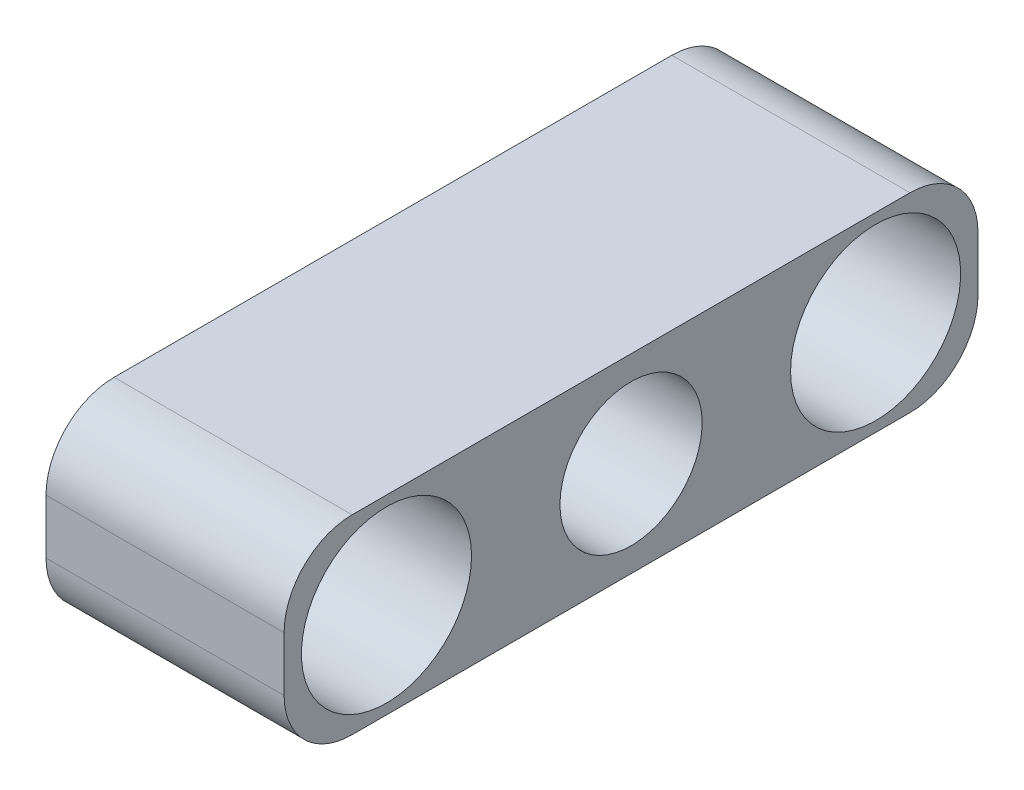
from build123d import *

# Parameters (mm, degrees)
BOSS_EXTRUDE1_START  = -17
BOSS_EXTRUDE1_DEPTH  = 35
SKETCH2_R            = 10.45
CUT_EXTRUDE1_DEPTH   = 32
SKETCH3_R            = 6.5
CUT_EXTRUDE2_DEPTH   = 62.814237842
SKETCH4_R            = 12.5
CUT_EXTRUDE3_DEPTH   = 64.419239983
FILLET5_R            = 10
FILLET6_R            = 10
FILLET5_OF_MIRROR1_R = 10
FILLET6_OF_MIRROR1_R = 10


with BuildPart() as part:
    # Sketch1 → Boss-Extrude1 (new body)
    with BuildSketch(Plane.YZ.offset(BOSS_EXTRUDE1_START)):
        with BuildLine():
            Line((-14, 0), (-14, 51))
            Line((-14, 51), (14, 51))
            Line((14, 51), (14, 0))
            ThreePointArc((14, 0), (0, -14), (-14, 0))
        make_face()
    boss_extrude1 = extrude(amount=BOSS_EXTRUDE1_DEPTH)

    # Sketch2 → Cut-Extrude1 (cut)
    with BuildSketch(Plane.YZ.offset(18)):
        with Locations(Location((0, 0, 0), (0, 0, 270))):
            Circle(SKETCH2_R)
    cut_extrude1 = extrude(amount=-CUT_EXTRUDE1_DEPTH, mode=Mode.SUBTRACT)

    # Sketch3 → Cut-Extrude2 (cut, through all)
    with BuildSketch(Plane.YZ.offset(-14)):
        with Locations(Location((0, 0, 0), (0, 0, 270))):
            Circle(SKETCH3_R)
    cut_extrude2 = extrude(amount=-CUT_EXTRUDE2_DEPTH, mode=Mode.SUBTRACT)

    # Sketch4 → Cut-Extrude3 (cut, through all)
    with BuildSketch(Plane.YZ.offset(18)):
        with Locations(Location((0, 35.95, 0), (0, 0, 270))):
            Circle(SKETCH4_R)
    cut_extrude3 = extrude(amount=-CUT_EXTRUDE3_DEPTH, mode=Mode.SUBTRACT)

    # Fillet5
    fillet5_edges = [part.edges().sort_by_distance(p)[0] for p in [
        (0.5, 14, 51),
    ]]
    fillet(fillet5_edges, radius=FILLET5_R)

    # Fillet6
    fillet6_edges = [part.edges().sort_by_distance(p)[0] for p in [
        (0.5, -14, 51),
    ]]
    fillet(fillet6_edges, radius=FILLET6_R)

    # Mirror1: Boss-Extrude1, Cut-Extrude1, Cut-Extrude2, Cut-Extrude3 across plane
    add(boss_extrude1.mirror(Plane.XY))
    add(cut_extrude1.mirror(Plane.XY), mode=Mode.SUBTRACT)
    add(cut_extrude2.mirror(Plane.XY), mode=Mode.SUBTRACT)
    add(cut_extrude3.mirror(Plane.XY), mode=Mode.SUBTRACT)

    # Fillet5 of Mirror1
    fillet5_of_mirror1_edges = [part.edges().sort_by_distance(p)[0] for p in [
        (0.5, 14, -51),
    ]]
    fillet(fillet5_of_mirror1_edges, radius=FILLET5_OF_MIRROR1_R)

    # Fillet6 of Mirror1
    fillet6_of_mirror1_edges = [part.edges().sort_by_distance(p)[0] for p in [
        (0.5, -14, -51),
    ]]
    fillet(fillet6_of_mirror1_edges, radius=FILLET6_OF_MIRROR1_R)


solid = part.part
